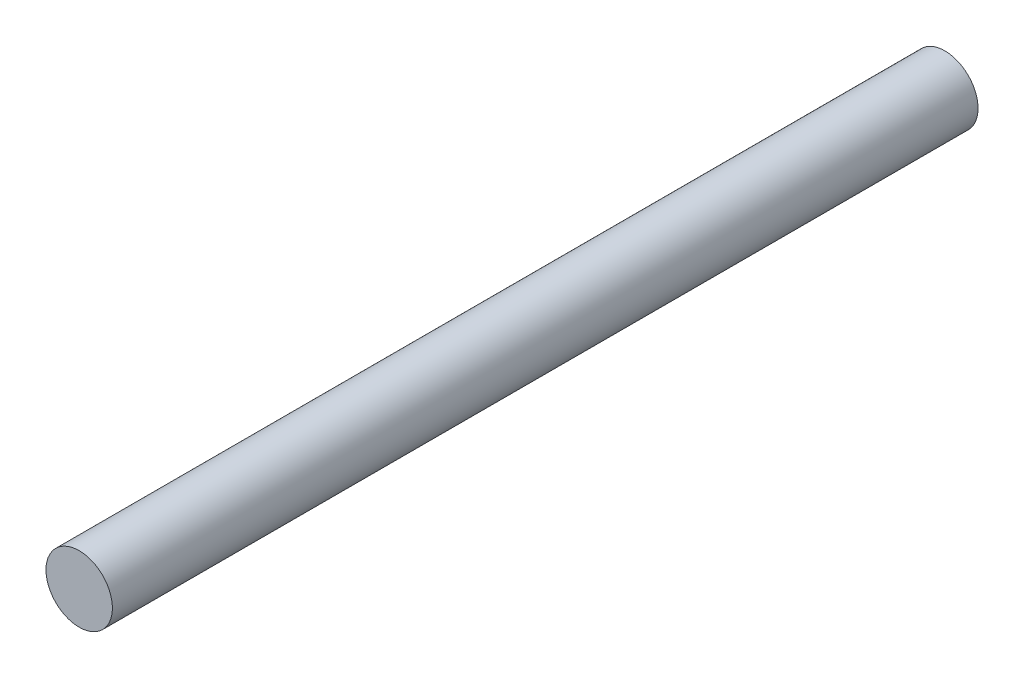
from build123d import *

# Parameters (mm, degrees)
SKETCH1_R           = 2.921
BOSS_EXTRUDE1_DEPTH = 76.2


with BuildPart() as part:
    # Sketch1 → Boss-Extrude1 (new body)
    with BuildSketch(Plane.XY):
        with Locations(Location((0, 0, 0), (0, 0, 180))):
            Circle(SKETCH1_R)
    extrude(amount=BOSS_EXTRUDE1_DEPTH)


solid = part.part
